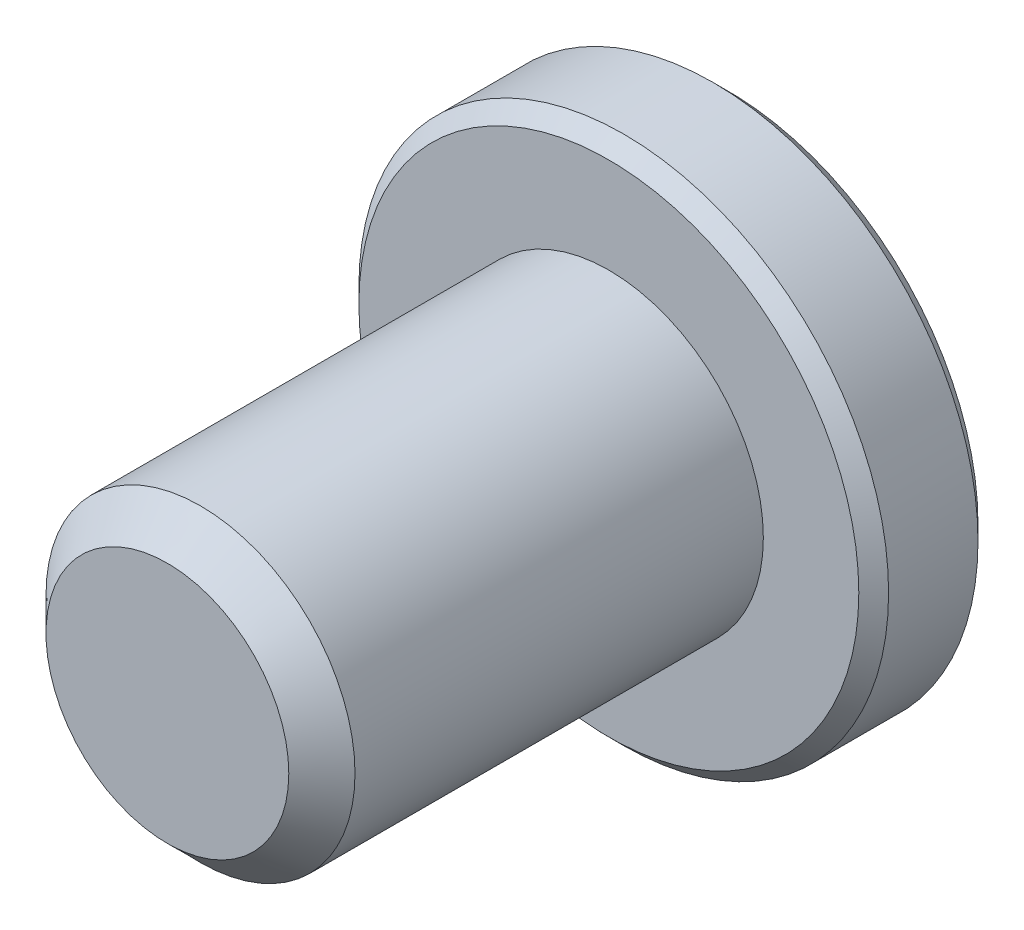
from build123d import *

# Parameters (mm, degrees)
EXTRUDE1_START     = -3.65
SKETCH1_R          = 3.5
EXTRUDE1_DEPTH     = 10
EXTRUDE2_START     = -6.35
SKETCH6_R          = 6
EXTRUDE2_DEPTH     = 2.7
CUT_EXTRUDE1_DEPTH = 2.025
CHAMFER1_SIZE      = 0.3375
CHAMFER2_SIZE      = 0.75


with BuildPart() as part:
    # Sketch1 → Extrude1 (new body)
    with BuildSketch(Plane.XY.offset(EXTRUDE1_START)):
        Circle(SKETCH1_R)
    extrude(amount=EXTRUDE1_DEPTH)

    # Sketch6 → Extrude2 (add)
    with BuildSketch(Plane.XY.offset(EXTRUDE2_START)):
        with Locations(Location((0, 0, 0), (0, 0, 180))):
            Circle(SKETCH6_R)
    extrude(amount=EXTRUDE2_DEPTH)

    # Sketch7 → Cut-Extrude1 (cut)
    with BuildSketch(Plane.XY.offset(-6.35)):
        Polygon((0, 2.598076211), (-2.25, 1.299038106), (-2.25, -1.299038106), (0, -2.598076211), (2.25, -1.299038106), (2.25, 1.299038106), align=None)
    extrude(amount=CUT_EXTRUDE1_DEPTH, mode=Mode.SUBTRACT)

    # Chamfer1
    chamfer1_edges = [part.edges().sort_by_distance(p)[0] for p in [
        (6, 0, -3.65),
        (6, 0, -6.35),
    ]]
    chamfer(chamfer1_edges, length=CHAMFER1_SIZE)

    # Chamfer2
    chamfer2_edges = [part.edges().sort_by_distance(p)[0] for p in [
        (-3.5, 0, 6.35),
    ]]
    chamfer(chamfer2_edges, length=CHAMFER2_SIZE)


solid = part.part
